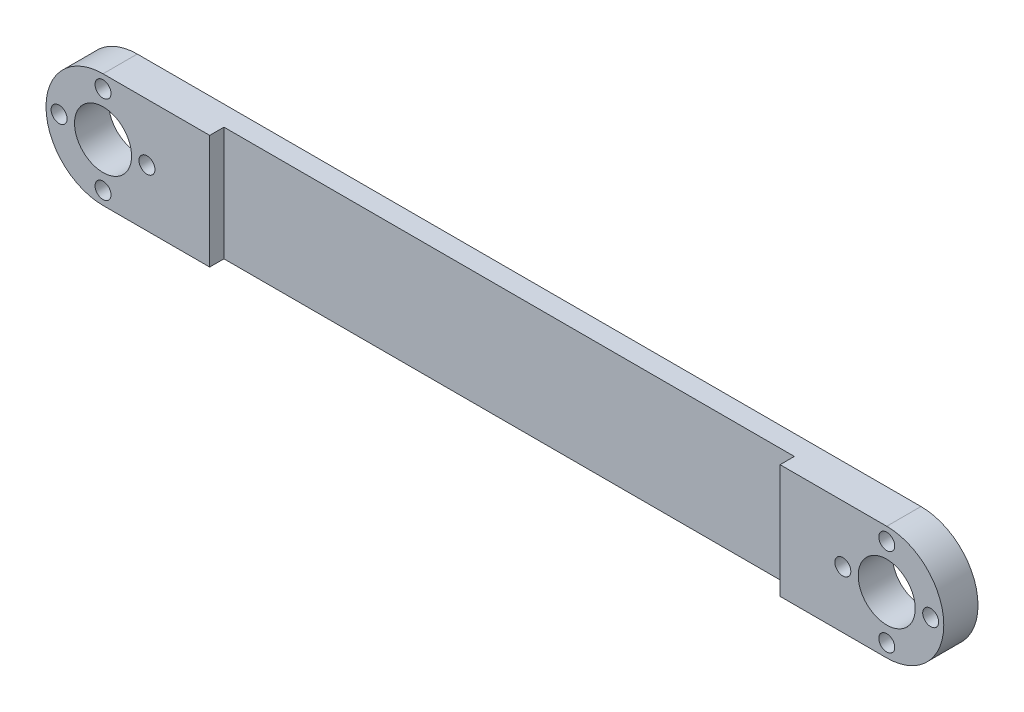
from build123d import *

# Parameters (mm, degrees)
SKETCH1_R               = 12.7
BOSS_EXTRUDE1_DEPTH     = 7.62
SKETCH2_R               = 6.35
CUT_EXTRUDE1_DEPTH      = 7.62
SKETCH3_R               = 1.778
CUT_EXTRUDE2_DEPTH      = 7.62
CIRPATTERN1_COUNT       = 4
MIRROR1_COPY_1_SKETCH_R = 1.778
MIRROR1_COPY_1_DEPTH    = 7.62
MIRROR1_COPY_2_SKETCH_R = 1.778
MIRROR1_COPY_2_DEPTH    = 7.62
MIRROR1_COPY_3_SKETCH_R = 1.778
MIRROR1_COPY_3_DEPTH    = 7.62
SKETCH4_W               = 127
SKETCH4_H               = 3.175
CUT_EXTRUDE3_DEPTH      = 25.4


with BuildPart() as part:
    # Sketch1 → Boss-Extrude1 (new body)
    with BuildSketch(Plane.XY):
        with BuildLine():
            ThreePointArc((-12.7, -25.4), (-25.4, -12.7), (-12.7, 0))
            Line((-12.7, 0), (-187.198, 0))
            ThreePointArc((-187.198, 0), (-178.217743879, -3.719743879), (-174.498, -12.7))
            ThreePointArc((-174.498, -12.7), (-178.217743879, -21.680256121), (-187.198, -25.4))
            Line((-187.198, -25.4), (-12.7, -25.4))
        make_face()
        with Locations((-187.198, -12.7)):
            Circle(SKETCH1_R)
        with Locations((-12.7, -12.7)):
            Circle(SKETCH1_R)
    extrude(amount=BOSS_EXTRUDE1_DEPTH)

    # Sketch2 → Cut-Extrude1 (cut)
    with BuildSketch(Plane.XY.offset(7.62)):
        with Locations((-12.7, -12.7)):
            Circle(SKETCH2_R)
    cut_extrude1 = extrude(amount=-CUT_EXTRUDE1_DEPTH, mode=Mode.SUBTRACT)

    # Sketch3 → Cut-Extrude2 (cut)
    with BuildSketch(Plane.XY.offset(7.62)):
        with Locations((-2.921, -12.7)):
            Circle(SKETCH3_R)
    cut_extrude2 = extrude(amount=-CUT_EXTRUDE2_DEPTH, mode=Mode.SUBTRACT)

    # CirPattern1: Cut-Extrude2 ×4 about axis
    cirpattern1_axis = Axis((-12.7, -12.7, 0), (0, 0, 1))
    for i in range(1, CIRPATTERN1_COUNT):
        add(cut_extrude2.rotate(cirpattern1_axis, i * 360 / CIRPATTERN1_COUNT), mode=Mode.SUBTRACT)

    # Mirror1: Cut-Extrude1, Cut-Extrude2 across plane
    add(cut_extrude1.mirror(Plane(origin=(-99.949, 0, 0), x_dir=(0, 0, 1), z_dir=(1, 0, 0))), mode=Mode.SUBTRACT)
    add(cut_extrude2.mirror(Plane(origin=(-99.949, 0, 0), x_dir=(0, 0, 1), z_dir=(1, 0, 0))), mode=Mode.SUBTRACT)

    # Mirror1 copy 1 sketch → Mirror1 copy 1 (cut)
    with BuildSketch(Plane(origin=(-174.498, 0, 7.62), x_dir=(0, 1, 0), z_dir=(0, 0, 1))):
        with Locations((-2.921, 12.7)):
            Circle(MIRROR1_COPY_1_SKETCH_R)
    extrude(amount=-MIRROR1_COPY_1_DEPTH, mode=Mode.SUBTRACT)

    # Mirror1 copy 2 sketch → Mirror1 copy 2 (cut)
    with BuildSketch(Plane(origin=(-174.498, -25.4, 7.62), x_dir=(1, 0, 0), z_dir=(0, 0, 1))):
        with Locations((-2.921, 12.7)):
            Circle(MIRROR1_COPY_2_SKETCH_R)
    extrude(amount=-MIRROR1_COPY_2_DEPTH, mode=Mode.SUBTRACT)

    # Mirror1 copy 3 sketch → Mirror1 copy 3 (cut)
    with BuildSketch(Plane(origin=(-199.898, -25.4, 7.62), x_dir=(0, -1, 0), z_dir=(0, 0, 1))):
        with Locations((-2.921, 12.7)):
            Circle(MIRROR1_COPY_3_SKETCH_R)
    extrude(amount=-MIRROR1_COPY_3_DEPTH, mode=Mode.SUBTRACT)

    # Sketch4 → Cut-Extrude3 (cut)
    with BuildSketch(Plane.XZ.offset(25.4)):
        with Locations((-99.949, 6.0325)):
            Rectangle(SKETCH4_W, SKETCH4_H)
    extrude(amount=-CUT_EXTRUDE3_DEPTH, mode=Mode.SUBTRACT)


solid = part.part
